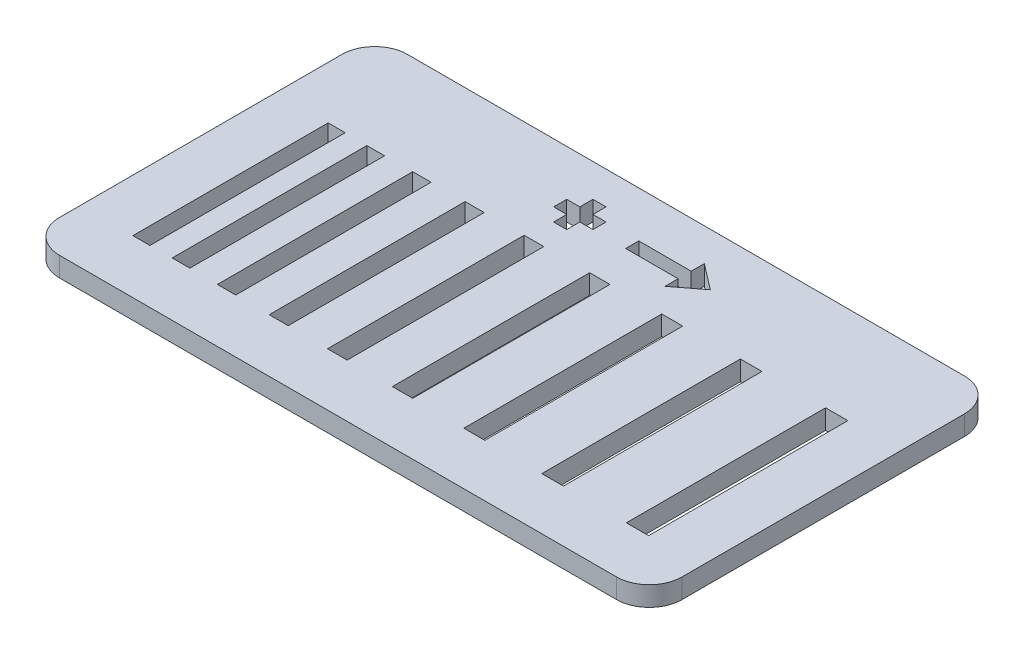
from build123d import *

# Parameters (mm, degrees)
SKETCH1_W           = 2.7
SKETCH1_H           = 29.7
SKETCH1_W_2         = 2.8
SKETCH1_H_2         = 29.8
SKETCH1_W_3         = 2.9
SKETCH1_H_3         = 29.9
SKETCH1_W_4         = 3
SKETCH1_H_4         = 30
SKETCH1_W_5         = 3.1
SKETCH1_H_5         = 30.1
SKETCH1_W_6         = 3.2
SKETCH1_H_6         = 30.2
SKETCH1_W_7         = 3.3
SKETCH1_H_7         = 30.3
SKETCH1_W_8         = 2.6
SKETCH1_W_9         = 3.4
SKETCH1_H_8         = 30.4
BOSS_EXTRUDE1_DEPTH = 3


with BuildPart() as part:
    # Sketch1 → Boss-Extrude1 (new body)
    with BuildSketch(Plane(origin=(0, 0, 0), x_dir=(1, 0, 0), z_dir=(0, 1, 0))):
        with BuildLine():
            Line((50.7, -23.1), (-34.3, -23.1))
            ThreePointArc((-34.3, -23.1), (-37.835533906, -21.635533906), (-39.3, -18.1))
            Line((-39.3, -18.1), (-39.3, 25))
            ThreePointArc((-39.3, 25), (-37.835533906, 28.535533906), (-34.3, 30))
            Line((-34.3, 30), (50.7, 30))
            ThreePointArc((50.7, 30), (54.235533906, 28.535533906), (55.7, 25))
            Line((55.7, 25), (55.7, -18.1))
            ThreePointArc((55.7, -18.1), (54.235533906, -21.635533906), (50.7, -23.1))
        make_face()
        Polygon((1, 21), (3, 21), (3, 23), (1, 23), (1, 25), (-1, 25), (-1, 23), (-3, 23), (-3, 21), (-1, 21), (-1, 19), (1, 19), align=None, mode=Mode.SUBTRACT)
        with Locations((-24, 0)):
            Rectangle(SKETCH1_W, SKETCH1_H, mode=Mode.SUBTRACT)
        with Locations((-17, 0)):
            Rectangle(SKETCH1_W_2, SKETCH1_H_2, mode=Mode.SUBTRACT)
        with Locations((-9, 0)):
            Rectangle(SKETCH1_W_3, SKETCH1_H_3, mode=Mode.SUBTRACT)
        Rectangle(SKETCH1_W_4, SKETCH1_H_4, mode=Mode.SUBTRACT)
        with Locations((10, 0)):
            Rectangle(SKETCH1_W_5, SKETCH1_H_5, mode=Mode.SUBTRACT)
        with Locations((21, 0)):
            Rectangle(SKETCH1_W_6, SKETCH1_H_6, mode=Mode.SUBTRACT)
        with Locations((33, 0)):
            Rectangle(SKETCH1_W_7, SKETCH1_H_7, mode=Mode.SUBTRACT)
        with Locations((-30, 0)):
            Rectangle(SKETCH1_W_8, SKETCH1_H_2, mode=Mode.SUBTRACT)
        with Locations((46, 0)):
            Rectangle(SKETCH1_W_9, SKETCH1_H_8, mode=Mode.SUBTRACT)
        Polygon((16, 23), (16, 25), (19.909676119, 22), (16, 19), (16, 21), (8, 21), (8, 23), align=None, mode=Mode.SUBTRACT)
    extrude(amount=BOSS_EXTRUDE1_DEPTH)


solid = part.part
